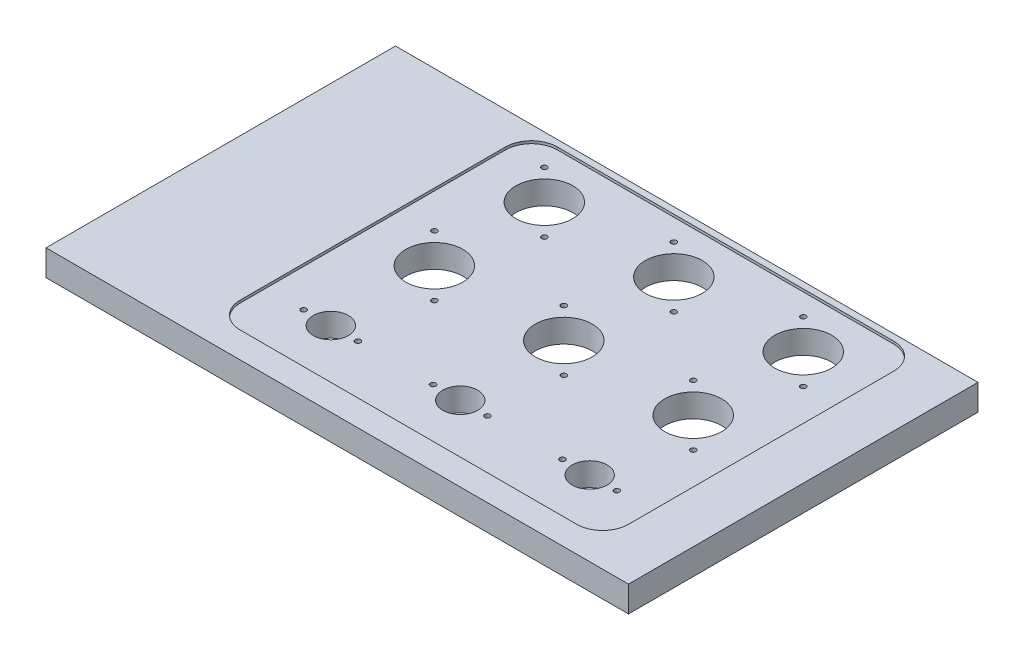
from build123d import *

# Parameters (mm, degrees)
SKETCH_1_W          = 450
SKETCH_1_H          = 270
EXTRUDE_1_DEPTH     = 20
SKETCH_1_3_W        = 300
SKETCH_1_3_H        = 245
CUT_EXTRUDE_1_DEPTH = 2
CUT_EXTRUDE_2_REACH = 265.154
SKETCH_1_4_R        = 22
SKETCH_1_4_R_2      = 13.5
FILLET_1_R          = 20
SKETCH_3_R          = 2.1
CUT_EXTRUDE_3_DEPTH = 10
SKETCH_4_R          = 3.35
CUT_EXTRUDE_4_DEPTH = 12


with BuildPart() as part:
    # 草图1 → 凸台-拉伸1 (new body)
    with BuildSketch(Plane(origin=(0, 0, 0), x_dir=(1, 0, 0), z_dir=(0, 1, 0))):
        Rectangle(SKETCH_1_W, SKETCH_1_H)
    extrude(amount=-EXTRUDE_1_DEPTH)

    # 草图1<3> → 切除-拉伸1 (cut)
    with BuildSketch(Plane(origin=(0, 0, 0), x_dir=(1, 0, 0), z_dir=(0, 1, 0))):
        with Locations((35, 7.5)):
            Rectangle(SKETCH_1_3_W, SKETCH_1_3_H)
    extrude(amount=-CUT_EXTRUDE_1_DEPTH, mode=Mode.SUBTRACT)

    # 草图1<4> → 切除-拉伸2 (cut, up to next)
    with BuildSketch(Plane(origin=(0, 0, 0), x_dir=(1, 0, 0), z_dir=(0, 1, 0)), mode=Mode.PRIVATE) as cut_extrude_2_sk1:
        with Locations((-65, 90)):
            Circle(SKETCH_1_4_R)
    cut_extrude_2_tool1 = extrude(cut_extrude_2_sk1.sketch, amount=-CUT_EXTRUDE_2_REACH, mode=Mode.PRIVATE) & part.part
    # 草图1<4> → 切除-拉伸2 (cut, up to next)
    with BuildSketch(Plane(origin=(0, 0, 0), x_dir=(1, 0, 0), z_dir=(0, 1, 0)), mode=Mode.PRIVATE) as cut_extrude_2_sk2:
        with Locations((35, 90)):
            Circle(SKETCH_1_4_R)
    cut_extrude_2_tool2 = extrude(cut_extrude_2_sk2.sketch, amount=-CUT_EXTRUDE_2_REACH, mode=Mode.PRIVATE) & part.part
    # 草图1<4> → 切除-拉伸2 (cut, up to next)
    with BuildSketch(Plane(origin=(0, 0, 0), x_dir=(1, 0, 0), z_dir=(0, 1, 0)), mode=Mode.PRIVATE) as cut_extrude_2_sk3:
        with Locations((135, 90)):
            Circle(SKETCH_1_4_R)
    cut_extrude_2_tool3 = extrude(cut_extrude_2_sk3.sketch, amount=-CUT_EXTRUDE_2_REACH, mode=Mode.PRIVATE) & part.part
    # 草图1<4> → 切除-拉伸2 (cut, up to next)
    with BuildSketch(Plane(origin=(0, 0, 0), x_dir=(1, 0, 0), z_dir=(0, 1, 0)), mode=Mode.PRIVATE) as cut_extrude_2_sk4:
        with Locations((135, 5)):
            Circle(SKETCH_1_4_R)
    cut_extrude_2_tool4 = extrude(cut_extrude_2_sk4.sketch, amount=-CUT_EXTRUDE_2_REACH, mode=Mode.PRIVATE) & part.part
    # 草图1<4> → 切除-拉伸2 (cut, up to next)
    with BuildSketch(Plane(origin=(0, 0, 0), x_dir=(1, 0, 0), z_dir=(0, 1, 0)), mode=Mode.PRIVATE) as cut_extrude_2_sk5:
        with Locations((35, 5)):
            Circle(SKETCH_1_4_R)
    cut_extrude_2_tool5 = extrude(cut_extrude_2_sk5.sketch, amount=-CUT_EXTRUDE_2_REACH, mode=Mode.PRIVATE) & part.part
    # 草图1<4> → 切除-拉伸2 (cut, up to next)
    with BuildSketch(Plane(origin=(0, 0, 0), x_dir=(1, 0, 0), z_dir=(0, 1, 0)), mode=Mode.PRIVATE) as cut_extrude_2_sk6:
        with Locations((-65, 5)):
            Circle(SKETCH_1_4_R)
    cut_extrude_2_tool6 = extrude(cut_extrude_2_sk6.sketch, amount=-CUT_EXTRUDE_2_REACH, mode=Mode.PRIVATE) & part.part
    # 草图1<4> → 切除-拉伸2 (cut, up to next)
    with BuildSketch(Plane(origin=(0, 0, 0), x_dir=(1, 0, 0), z_dir=(0, 1, 0)), mode=Mode.PRIVATE) as cut_extrude_2_sk7:
        with Locations((-65, -75)):
            Circle(SKETCH_1_4_R_2)
    cut_extrude_2_tool7 = extrude(cut_extrude_2_sk7.sketch, amount=-CUT_EXTRUDE_2_REACH, mode=Mode.PRIVATE) & part.part
    # 草图1<4> → 切除-拉伸2 (cut, up to next)
    with BuildSketch(Plane(origin=(0, 0, 0), x_dir=(1, 0, 0), z_dir=(0, 1, 0)), mode=Mode.PRIVATE) as cut_extrude_2_sk8:
        with Locations((35, -75)):
            Circle(SKETCH_1_4_R_2)
    cut_extrude_2_tool8 = extrude(cut_extrude_2_sk8.sketch, amount=-CUT_EXTRUDE_2_REACH, mode=Mode.PRIVATE) & part.part
    # 草图1<4> → 切除-拉伸2 (cut, up to next)
    with BuildSketch(Plane(origin=(0, 0, 0), x_dir=(1, 0, 0), z_dir=(0, 1, 0)), mode=Mode.PRIVATE) as cut_extrude_2_sk9:
        with Locations((135, -75)):
            Circle(SKETCH_1_4_R_2)
    cut_extrude_2_tool9 = extrude(cut_extrude_2_sk9.sketch, amount=-CUT_EXTRUDE_2_REACH, mode=Mode.PRIVATE) & part.part
    add(cut_extrude_2_tool1.solids().sort_by_distance((-65, 0, -90))[0], mode=Mode.SUBTRACT)
    add(cut_extrude_2_tool2.solids().sort_by_distance((35, 0, -90))[0], mode=Mode.SUBTRACT)
    add(cut_extrude_2_tool3.solids().sort_by_distance((135, 0, -90))[0], mode=Mode.SUBTRACT)
    add(cut_extrude_2_tool4.solids().sort_by_distance((135, 0, -5))[0], mode=Mode.SUBTRACT)
    add(cut_extrude_2_tool5.solids().sort_by_distance((35, 0, -5))[0], mode=Mode.SUBTRACT)
    add(cut_extrude_2_tool6.solids().sort_by_distance((-65, 0, -5))[0], mode=Mode.SUBTRACT)
    add(cut_extrude_2_tool7.solids().sort_by_distance((-65, 0, 75))[0], mode=Mode.SUBTRACT)
    add(cut_extrude_2_tool8.solids().sort_by_distance((35, 0, 75))[0], mode=Mode.SUBTRACT)
    add(cut_extrude_2_tool9.solids().sort_by_distance((135, 0, 75))[0], mode=Mode.SUBTRACT)

    # 圆角1
    fillet_1_edges = [part.edges().sort_by_distance(p)[0] for p in [
        (-115, -1, 115),
        (185, -1, 115),
        (185, -1, -130),
        (-115, -1, -130),
    ]]
    fillet(fillet_1_edges, radius=FILLET_1_R)

    # 草图3 → 切除-拉伸3 (cut)
    with BuildSketch(Plane(origin=(0, -2, 0), x_dir=(1, 0, 0), z_dir=(0, 1, 0))):
        with Locations((-41.665476221, 66.665476221)):
            Circle(SKETCH_3_R)
        with Locations((-88.334523779, 113.334523779)):
            Circle(SKETCH_3_R)
        with Locations((58.334523779, 66.665476221)):
            Circle(SKETCH_3_R)
        with Locations((11.665476221, 113.334523779)):
            Circle(SKETCH_3_R)
        with Locations((158.334523779, 66.665476221)):
            Circle(SKETCH_3_R)
        with Locations((111.665476221, 113.334523779)):
            Circle(SKETCH_3_R)
        with Locations((58.334523779, -18.334523779)):
            Circle(SKETCH_3_R)
        with Locations((11.665476221, 28.334523779)):
            Circle(SKETCH_3_R)
        with Locations((158.334523779, -18.334523779)):
            Circle(SKETCH_3_R)
        with Locations((111.665476221, 28.334523779)):
            Circle(SKETCH_3_R)
        with Locations((-41.665476221, -18.334523779)):
            Circle(SKETCH_3_R)
        with Locations((-88.334523779, 28.334523779)):
            Circle(SKETCH_3_R)
        with Locations((-86, -75)):
            Circle(SKETCH_3_R)
        with Locations((-44, -75)):
            Circle(SKETCH_3_R)
        with Locations((14, -75)):
            Circle(SKETCH_3_R)
        with Locations((56, -75)):
            Circle(SKETCH_3_R)
        with Locations((114, -75)):
            Circle(SKETCH_3_R)
        with Locations((156, -75)):
            Circle(SKETCH_3_R)
    extrude(amount=-CUT_EXTRUDE_3_DEPTH, mode=Mode.SUBTRACT)

    # 草图4 → 切除-拉伸4 (cut)
    with BuildSketch(Plane.XZ.offset(20)):
        with Locations((-124, 65)):
            Circle(SKETCH_4_R)
        with Locations((210, 65)):
            Circle(SKETCH_4_R)
        with Locations((210, 30)):
            Circle(SKETCH_4_R)
        with Locations((210, -70)):
            Circle(SKETCH_4_R)
        with Locations((-174, -70)):
            Circle(SKETCH_4_R)
        with Locations((-174, 30)):
            Circle(SKETCH_4_R)
        with Locations((-124, -105)):
            Circle(SKETCH_4_R)
        with Locations((100, -105)):
            Circle(SKETCH_4_R)
        with Locations((100, -5)):
            Circle(SKETCH_4_R)
    extrude(amount=-CUT_EXTRUDE_4_DEPTH, mode=Mode.SUBTRACT)


solid = part.part
